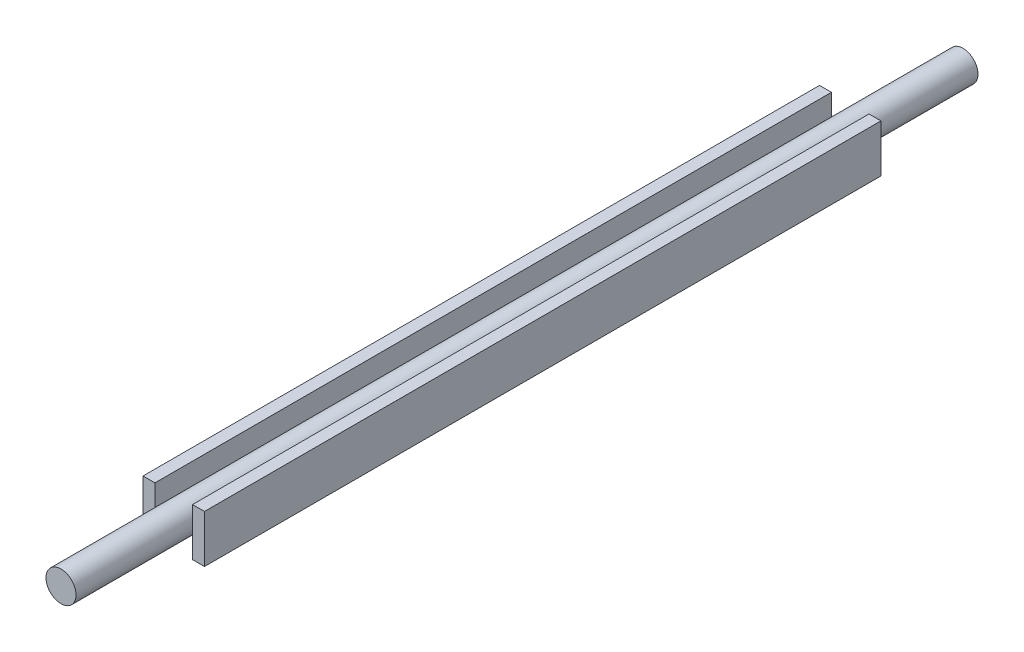
from build123d import *

# Parameters (mm, degrees)
SKETCH1_W             = 3.175
SKETCH1_H             = 12.7
BOSS_EXTRUDE1_DEPTH   = 90
BOSS_EXTRUDE1_2_DEPTH = 90
SKETCH1_3_R           = 4
BOSS_EXTRUDE2_DEPTH   = 120


with BuildPart() as part:
    # Sketch1 → Boss-Extrude1 (new, symmetric)
    with BuildSketch(Plane.XY):
        with Locations((6.5875, 0)):
            Rectangle(SKETCH1_W, SKETCH1_H)
    extrude(amount=BOSS_EXTRUDE1_DEPTH, both=True)


with BuildPart() as body_2:
    # Sketch1 → Boss-Extrude1 2 (new, symmetric)
    with BuildSketch(Plane.XY):
        with Locations((-6.5875, 0)):
            Rectangle(SKETCH1_W, SKETCH1_H)
    extrude(amount=BOSS_EXTRUDE1_2_DEPTH, both=True)


with BuildPart() as body_3:
    # Sketch1<3> → Boss-Extrude2 (new, symmetric)
    with BuildSketch(Plane.XY):
        Circle(SKETCH1_3_R)
    extrude(amount=BOSS_EXTRUDE2_DEPTH, both=True)


solid = Compound([part.part, body_2.part, body_3.part])
